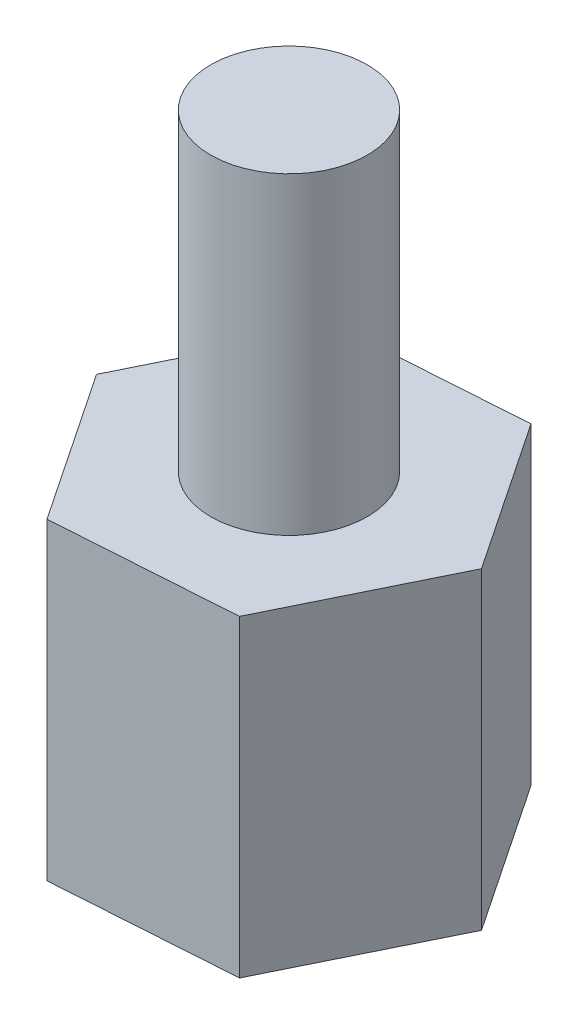
from build123d import *

# Parameters (mm, degrees)
BOSS_EXTRUDE1_DEPTH = 6.35
SKETCH2_R           = 1.5875
BOSS_EXTRUDE2_DEPTH = 6.35
SKETCH3_R           = 1.5875
CUT_EXTRUDE1_DEPTH  = 4.7625


with BuildPart() as part:
    # Sketch1 → Boss-Extrude1 (new body)
    with BuildSketch(Plane(origin=(0, 0, 0), x_dir=(1, 0, 0), z_dir=(0, 1, 0))):
        Polygon((1.616430432, 3.290590523), (-2.04151977, 3.045165079), (-3.657950203, -0.245425444), (-1.616430432, -3.290590523), (2.04151977, -3.045165079), (3.657950203, 0.245425444), align=None)
    extrude(amount=BOSS_EXTRUDE1_DEPTH)

    # Sketch2 → Boss-Extrude2 (add)
    with BuildSketch(Plane(origin=(0, 6.35, 0), x_dir=(1, 0, 0), z_dir=(0, 1, 0))):
        with Locations(Location((0, 0, 0), (0, 0, 270))):
            Circle(SKETCH2_R)
    extrude(amount=BOSS_EXTRUDE2_DEPTH)

    # Sketch3 → Cut-Extrude1 (cut)
    with BuildSketch(Plane(origin=(0, 0, 0), x_dir=(-1, 0, 0), z_dir=(0, -1, 0))):
        with Locations(Location((0, 0, 0), (0, 0, 270))):
            Circle(SKETCH3_R)
    extrude(amount=-CUT_EXTRUDE1_DEPTH, mode=Mode.SUBTRACT)


solid = part.part
